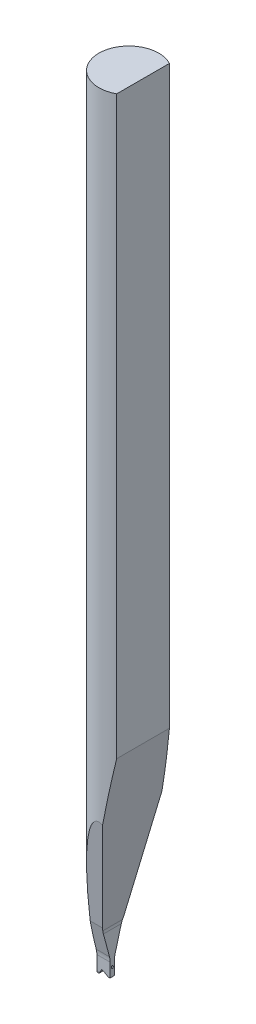
from build123d import *

# Parameters (mm, degrees)
TD_REV_FEATURE_DEPTH            = 21.0312
ISA_REV_FEATURE_DEPTH           = 22.061040395
ISA_REV_FEATURE_DEPTH_BACK      = 22.061040395
BA_REV_FEATURE_DEPTH            = 22.061040395
BA_REV_FEATURE_DEPTH_BACK       = 22.061040395
SLB_REV_FEATURE_DEPTH           = 22.061040395
SLB_REV_FEATURE_DEPTH_BACK      = 22.061040395
VR_REV_FEATURE_DEPTH            = 22.061040395
VR_REV_FEATURE_DEPTH_BACK       = 22.061040395
ND_REV_FEATURE_DEPTH            = 22.061040503
ND_REV_FEATURE_DEPTH_BACK       = 22.061040503
REV_HOLE_CUT_FEATURE_DEPTH      = 22.162851782
REV_HOLE_CUT_FEATURE_DEPTH_BACK = 22.162851782
REV_F_FR_FEATURE_R              = 0.0254
REV_F_BR_FEATURE_R              = 0.0254


with BuildPart() as part:
    # td_rev_sketch → td_rev_feature (new body)
    with BuildSketch(Plane(origin=(0, 0, 0), x_dir=(1, 0, 0), z_dir=(0, 1, 0))):
        with BuildLine():
            Line((0.37592, -0.697645113), (0.37592, 0.697645113))
            ThreePointArc((0.37592, 0.697645113), (-0.79248, 0), (0.37592, -0.697645113))
        make_face()
    extrude(amount=TD_REV_FEATURE_DEPTH)

    # isa_rev_sketch → isa_rev_feature (cut, two sides: drawn at the far end of the back side and taken through both)
    with BuildSketch(Plane(origin=(0, 0, 0), x_dir=(0, 0, -1), z_dir=(1, 0, 0)).offset(-ISA_REV_FEATURE_DEPTH_BACK)):
        Polygon((8.398066277, 47.339699483), (0.79248, 4.2062763), (0.0508, 0), (-0.0508, 0), (-0.79248, 4.2062763), (-8.398066277, 47.339699483), (-8.398066277, -40.25795204), (8.398066277, -40.25795204), align=None)
    extrude(amount=ISA_REV_FEATURE_DEPTH + ISA_REV_FEATURE_DEPTH_BACK, mode=Mode.SUBTRACT)

    # ba_rev_sketch → ba_rev_feature (cut, two sides: drawn at the far end of the back side and taken through both)
    with BuildSketch(Plane.XY.offset(-BA_REV_FEATURE_DEPTH_BACK)):
        Polygon((-52.01559187, -9.04993148), (-0.69088, 0), (-0.428729423, 0.04622422), (0.37592, 4.609617863), (9.42585148, 55.934329733), (85.165346017, -15.675992153), (23.723902667, -80.660253365), align=None)
    extrude(amount=BA_REV_FEATURE_DEPTH + BA_REV_FEATURE_DEPTH_BACK, mode=Mode.SUBTRACT)

    # slb_rev_sketch → slb_rev_feature (cut, two sides: drawn at the far end of the back side and taken through both)
    with BuildSketch(Plane.XY.offset(-SLB_REV_FEATURE_DEPTH_BACK)):
        with BuildLine():
            Line((-0.43688, -52.09380084), (-0.43688, 0))
            Line((-0.43688, 0), (-0.43688, 1.143))
            ThreePointArc((-0.43688, 1.143), (-0.434946907, 1.187275117), (-0.429162339, 1.231213274))
            Line((-0.429162339, 1.231213274), (0.37592, 5.797062104))
            Line((0.37592, 5.797062104), (9.421913584, 57.099441055))
            Line((9.421913584, 57.099441055), (113.187433376, 47.730703366))
            Line((113.187433376, 47.730703366), (103.328639792, -61.462538529))
            Line((103.328639792, -61.462538529), (-0.43688, -52.09380084))
        make_face()
    extrude(amount=SLB_REV_FEATURE_DEPTH + SLB_REV_FEATURE_DEPTH_BACK, mode=Mode.SUBTRACT)

    # vr_rev_sketch → vr_rev_feature (cut, two sides: drawn at the far end of the back side and taken through both)
    with BuildSketch(Plane(origin=(0, 0, 0), x_dir=(0, 0, -1), z_dir=(1, 0, 0)).offset(-VR_REV_FEATURE_DEPTH_BACK)):
        with BuildLine():
            Line((12.638111697, 47.42606773), (0.79248, 3.217568389))
            Line((0.79248, 3.217568389), (0.07445968, 0.537880075))
            ThreePointArc((0.07445968, 0.537880075), (0.06149601, 0.472707306), (0.05715, 0.4064))
            Line((0.05715, 0.4064), (0.05715, 0))
            Line((0.05715, 0), (-0.05715, 0))
            Line((-0.05715, 0), (-0.05715, 0.4064))
            ThreePointArc((-0.05715, 0.4064), (-0.06149601, 0.472707306), (-0.07445968, 0.537880075))
            Line((-0.07445968, 0.537880075), (-0.79248, 3.217568389))
            Line((-0.79248, 3.217568389), (-12.638111697, 47.42606773))
            Line((-12.638111697, 47.42606773), (-12.638111697, -44.109944949))
            Line((-12.638111697, -44.109944949), (12.638111697, -44.109944949))
            Line((12.638111697, -44.109944949), (12.638111697, 47.42606773))
        make_face()
    extrude(amount=VR_REV_FEATURE_DEPTH + VR_REV_FEATURE_DEPTH_BACK, mode=Mode.SUBTRACT)

    # erw_rev_sketch → nd_rev_feature (cut, two sides: drawn at the far end of the back side and taken through both)
    with BuildSketch(Plane.XY.offset(-ND_REV_FEATURE_DEPTH_BACK)):
        with BuildLine():
            Line((-0.73406, 0), (-0.668068864, 0.1143))
            ThreePointArc((-0.668068864, 0.1143), (-0.652645823, 0.126134516), (-0.633371819, 0.123597045))
            Line((-0.633371819, 0.123597045), (-0.476954112, 0.03328924))
            Line((-0.476954112, 0.03328924), (-0.419295457, 0))
            Line((-0.419295457, 0), (-0.73406, 0))
        make_face()
    extrude(amount=ND_REV_FEATURE_DEPTH + ND_REV_FEATURE_DEPTH_BACK, mode=Mode.SUBTRACT)


with BuildPart() as body_2:
    # rev_hole_sketch → rev_hole_feature (revolve)
    with BuildSketch(Plane.XY):
        Polygon((-0.703570884, -0.035921024), (-0.721531396, -0.017960512), (1.354405484, 2.057976368), (2.104599043, 1.307782809), (-0.395400957, 0.272248903), align=None)
    revolve(axis=Axis((-0.721531396, -0.017960512, 0), (0.7071067811865462, 0.7071067811865489, 0)))

    # rev_hole_cut_sketch → rev_hole_cut_feature (cut, two sides: drawn at the far end of the back side and taken through both)
    with BuildSketch(Plane.XY.offset(-REV_HOLE_CUT_FEATURE_DEPTH_BACK)):
        Polygon((-46.14120993, 26.397559629), (-0.79248, 0.215458196), (-0.419295457, 0), (44.929434473, -26.182101432), (-7.434768392, -116.879561292), (-98.505412795, -64.299900231), align=None)
    extrude(amount=REV_HOLE_CUT_FEATURE_DEPTH + REV_HOLE_CUT_FEATURE_DEPTH_BACK, mode=Mode.SUBTRACT)


with BuildPart() as part_1:
    add(part.part)

    # rev_hole_combine: cut body 2
    add(body_2.part, mode=Mode.SUBTRACT)

    # rev_f_fr_feature
    rev_f_fr_feature_edges = [part_1.edges().sort_by_distance(p)[0] for p in [
        (-0.79248, 0, 0),
    ]]
    fillet(rev_f_fr_feature_edges, radius=REV_F_FR_FEATURE_R)

    # rev_f_br_feature
    rev_f_br_feature_edges = [part_1.edges().sort_by_distance(p)[0] for p in [
        (-0.73406, 0, 0),
    ]]
    fillet(rev_f_br_feature_edges, radius=REV_F_BR_FEATURE_R)


solid = part_1.part
